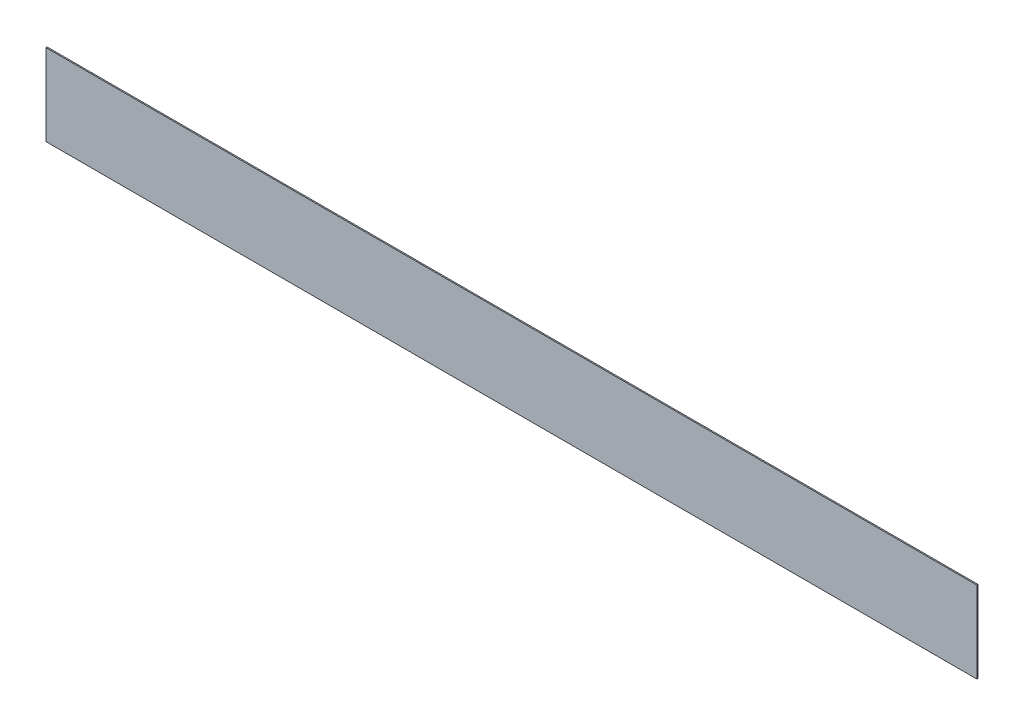
from build123d import *

# Parameters (mm, degrees)
SKETCH_1_W      = 8000
SKETCH_1_H      = 700
EXTRUDE_1_DEPTH = 10


with BuildPart() as part:
    # 草图1 → 凸台-拉伸1 (new body)
    with BuildSketch(Plane.XY):
        Rectangle(SKETCH_1_W, SKETCH_1_H)
    extrude(amount=EXTRUDE_1_DEPTH)


solid = part.part
